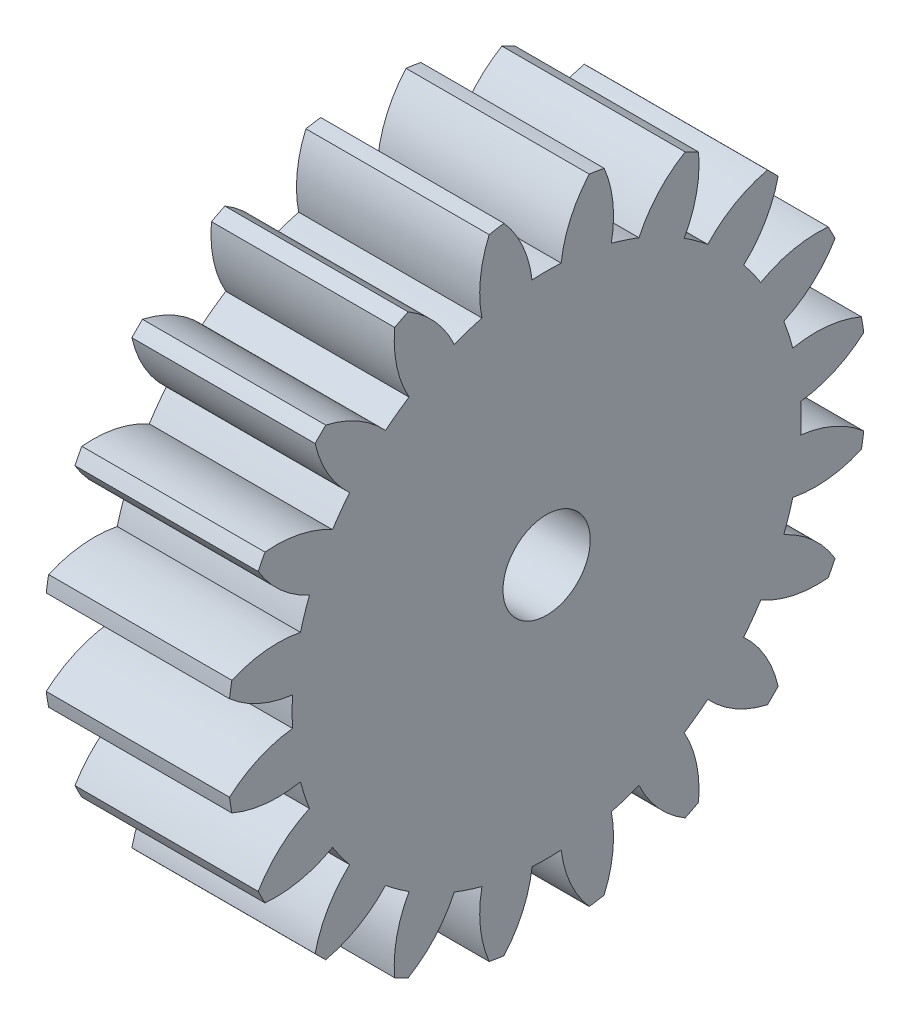
from build123d import *

# Parameters (mm, degrees)
BASPROSKE_W     = 6.3
BASPROSKE_H     = 11
TOOTHCUT_DEPTH  = 17.78362297
TEETHCUTS_COUNT = 20
TEETHCUTS_ANGLE = 342
BORSKE_R        = 1.5
BORE_DEPTH      = 50.0000508


with BuildPart() as part:
    # BasProSke → Base-Revolve (revolve)
    with BuildSketch(Plane(origin=(0, 0, 0), x_dir=(1, 0, 0), z_dir=(0, 1, 0)), mode=Mode.PRIVATE) as base_revolve_sk:
        with Locations((3.15, 5.5)):
            Rectangle(BASPROSKE_W, BASPROSKE_H)
    revolve(base_revolve_sk.sketch.rotate(Axis((-10, 0, 0), (1, 0, 0)), 180), axis=Axis((-10, 0, 0), (1, 0, 0)))

    # TooCutSke → ToothCut (cut, through all)
    with BuildSketch(Plane(origin=(0, 0, 0), x_dir=(0, 0, -1), z_dir=(1, 0, 0))):
        with BuildLine():
            ThreePointArc((0.499924007, 8.734705318), (0, 8.749), (-0.499924007, 8.734705318))
            ThreePointArc((-0.499924007, 8.734705318), (-0.824302243, 9.905497836), (-1.485192705, 10.924909509))
            ThreePointArc((-1.485192705, 10.924909509), (0, 11.0254), (1.485192705, 10.924909509))
            ThreePointArc((1.485192705, 10.924909509), (0.824302243, 9.905497836), (0.499924007, 8.734705318))
        make_face()
    toothcut = extrude(amount=TOOTHCUT_DEPTH, mode=Mode.SUBTRACT)

    # TeethCuts: ToothCut ×20 about axis
    teethcuts_axis = Axis((-10, 0, 0), (1, 0, 0))
    for i in range(1, TEETHCUTS_COUNT):
        add(toothcut.rotate(teethcuts_axis, i * TEETHCUTS_ANGLE / (TEETHCUTS_COUNT - 1)), mode=Mode.SUBTRACT)

    # BorSke → Bore (cut, symmetric)
    with BuildSketch(Plane(origin=(0, 0, 0), x_dir=(0, 0, -1), z_dir=(1, 0, 0))):
        with Locations(Location((0, 0, 0), (0, 0, 180))):
            Circle(BORSKE_R)
    extrude(amount=BORE_DEPTH, both=True, mode=Mode.SUBTRACT)


solid = part.part
